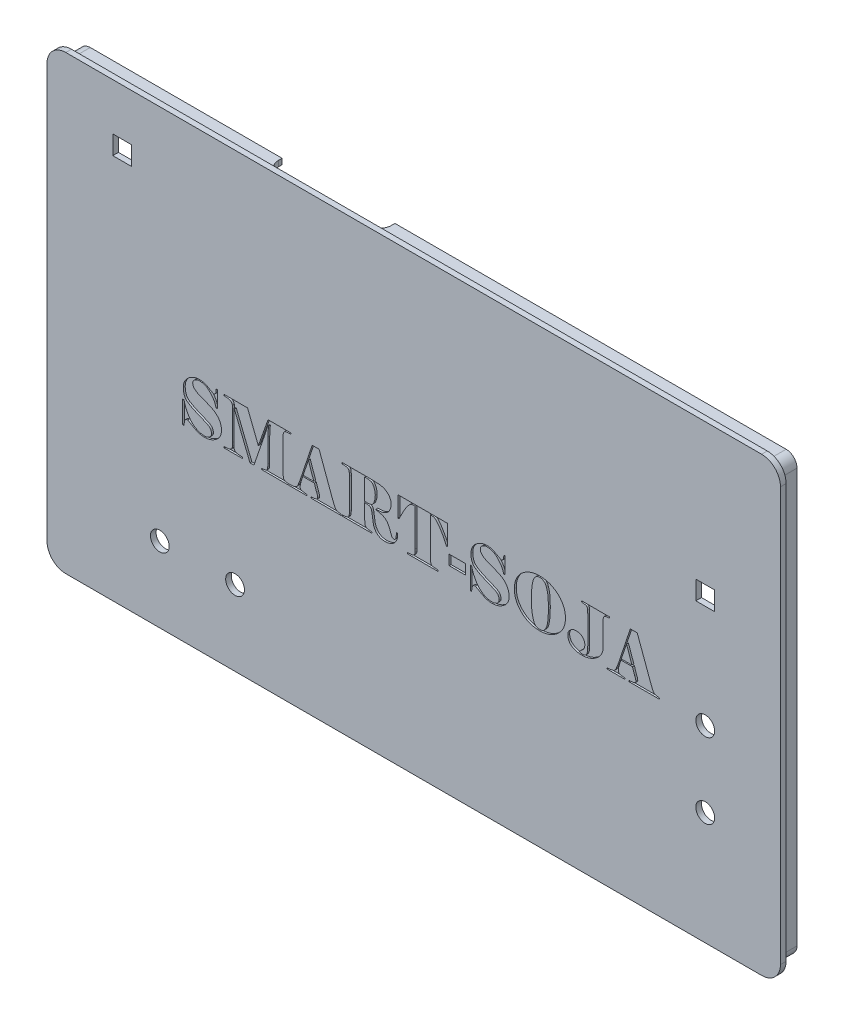
from build123d import *

# Parameters (mm, degrees)
BOSS_EXTRU_1_DEPTH      = 1.5
BOSS_EXTRU_2_DEPTH      = 5
ENL_V_MAT_EXTRU_1_DEPTH = 5
ESQUISSE4_R             = 2.5
ENL_V_MAT_EXTRU_2_DEPTH = 5
ESQUISSE5_W             = 5
ESQUISSE5_H             = 5
ENL_V_MAT_EXTRU_3_DEPTH = 5
ESQUISSE6_W             = 4.3693928
ESQUISSE6_H             = 2.652845629
ENL_V_MAT_EXTRU_4_DEPTH = 0.5


with BuildPart() as part:
    # Esquisse1 → Boss.-Extru.1 (new body)
    with BuildSketch(Plane.XY):
        with BuildLine():
            Line((5, 0), (190, 0))
            ThreePointArc((190, 0), (193.535533906, 1.464466094), (195, 5))
            Line((195, 5), (195, 115))
            ThreePointArc((195, 115), (193.535533906, 118.535533906), (190, 120))
            Line((190, 120), (5, 120))
            ThreePointArc((5, 120), (1.464466094, 118.535533906), (0, 115))
            Line((0, 115), (0, 5))
            ThreePointArc((0, 5), (1.464466094, 1.464466094), (5, 0))
        make_face()
    extrude(amount=BOSS_EXTRU_1_DEPTH)

    # Esquisse2 → Boss.-Extru.2 (add)
    with BuildSketch(Plane(origin=(0, 0, 0), x_dir=(-1, 0, 0), z_dir=(0, 0, -1))):
        with BuildLine():
            Line((-190, 2.1), (-5, 2.1))
            ThreePointArc((-5, 2.1), (-2.949390335, 2.949390335), (-2.1, 5))
            Line((-2.1, 5), (-2.1, 115))
            ThreePointArc((-2.1, 115), (-2.949390335, 117.050609665), (-5, 117.9))
            Line((-5, 117.9), (-190, 117.9))
            ThreePointArc((-190, 117.9), (-192.050609665, 117.050609665), (-192.9, 115))
            Line((-192.9, 115), (-192.9, 5))
            ThreePointArc((-192.9, 5), (-192.050609665, 2.949390335), (-190, 2.1))
        make_face()
        with BuildLine():
            Line((-190, 3.6), (-5, 3.6))
            ThreePointArc((-5, 3.6), (-4.010050506, 4.010050506), (-3.6, 5))
            Line((-3.6, 5), (-3.6, 115))
            ThreePointArc((-3.6, 115), (-4.010050506, 115.989949494), (-5, 116.4))
            Line((-5, 116.4), (-190, 116.4))
            ThreePointArc((-190, 116.4), (-190.989949494, 115.989949494), (-191.4, 115))
            Line((-191.4, 115), (-191.4, 5))
            ThreePointArc((-191.4, 5), (-190.989949494, 4.010050506), (-190, 3.6))
        make_face(mode=Mode.SUBTRACT)
    extrude(amount=BOSS_EXTRU_2_DEPTH)

    # Esquisse3 → Enlèv. mat.-Extru.1 (cut)
    with BuildSketch(Plane(origin=(0, 117.9, 0), x_dir=(1, 0, 0), z_dir=(0, 1, 0))):
        with BuildLine():
            Line((56, 5), (86, 5))
            Line((86, 5), (86, 4))
            ThreePointArc((86, 4), (85.121320344, 1.878679656), (83, 1))
            Line((83, 1), (59, 1))
            ThreePointArc((59, 1), (56.878679656, 1.878679656), (56, 4))
            Line((56, 4), (56, 5))
        make_face()
    extrude(amount=-ENL_V_MAT_EXTRU_1_DEPTH, mode=Mode.SUBTRACT)

    # Esquisse4 → Enlèv. mat.-Extru.2 (cut)
    with BuildSketch(Plane.XY.offset(1.5)):
        with Locations((30, 20)):
            Circle(ESQUISSE4_R)
        with Locations((50, 20)):
            Circle(ESQUISSE4_R)
        with Locations((175, 50)):
            Circle(ESQUISSE4_R)
        with Locations((175, 30)):
            Circle(ESQUISSE4_R)
    extrude(amount=-ENL_V_MAT_EXTRU_2_DEPTH, mode=Mode.SUBTRACT)

    # Esquisse5 → Enlèv. mat.-Extru.3 (cut)
    with BuildSketch(Plane.XY.offset(1.5)):
        with Locations((175, 80)):
            Rectangle(ESQUISSE5_W, ESQUISSE5_H)
        with Locations((20, 105)):
            Rectangle(ESQUISSE5_W, ESQUISSE5_H)
    extrude(amount=-ENL_V_MAT_EXTRU_3_DEPTH, mode=Mode.SUBTRACT)

    # Esquisse6 → Enlèv. mat.-Extru.4 (cut)
    # profile 1 of 10: a face of its own
    with BuildSketch(Plane.XY.offset(1.5)):
        with BuildLine():
            add(Edge.make_bspline(
                [(46.39163123, 53.64766274), (46.387533953, 53.511673528), (46.379485564, 53.244546364), (46.312296236, 52.852726032), (46.198904992, 52.480994989), (46.045498017, 52.125705335), (45.841977188, 51.792423584), (45.597287318, 51.475265037), (45.303754084, 51.180898705), (44.975147254, 50.905788926), (44.620342088, 50.658723814), (44.253987273, 50.440344135), (43.879804417, 50.256560965), (43.49711664, 50.106990197), (43.106385426, 49.990222972), (42.708129786, 49.903349708), (42.301428774, 49.854489483), (42.028050702, 49.847476846), (41.890571459, 49.843950257)],
                knots=[0, 0, 0, 0, 1.00009757, 1.964517807, 2.914178975, 3.854093948, 4.803755116, 5.77980362, 6.79466672, 7.855864323, 8.929224374, 9.972220948, 10.991163209, 11.992814961, 12.991731883, 13.988677953, 14.988525199, 16, 16, 16, 16], degree=3))
            add(Edge.make_bspline(
                [(41.890571459, 49.843950257), (41.768577277, 49.847224302), (41.524802925, 49.853766648), (41.160068953, 49.892429425), (40.79823166, 49.96303579), (40.435579764, 50.05410212), (40.075201369, 50.178564985), (39.712991476, 50.323253456), (39.355147439, 50.500446651), (39.006346872, 50.69791869), (38.679712425, 50.898227484), (38.37777251, 51.069455861), (38.118442274, 51.220983404), (37.892453331, 51.338868244), (37.706757674, 51.437359079), (37.554651448, 51.500252331), (37.444281492, 51.548995454), (37.379986707, 51.557313448), (37.355375807, 51.560497429)],
                knots=[0, 0, 0, 0, 1.191920636, 2.381750298, 3.577683791, 4.790887597, 6.031223829, 7.29920578, 8.59883538, 9.928364723, 11.213776967, 12.341394632, 13.319310994, 14.146917292, 14.832227275, 15.369147203, 15.758520767, 16, 16, 16, 16], degree=3))
            add(Edge.make_bspline(
                [(37.355375807, 51.560497429), (37.270208805, 51.556829681), (37.11386622, 51.550096731), (36.901863154, 51.476793998), (36.74123783, 51.346281127), (36.64540204, 51.154796759), (36.585686991, 50.91531345), (36.52266294, 50.618075409), (36.459433602, 50.253809392), (36.423767226, 49.987956042), (36.404447686, 49.843950257)],
                knots=[0, 0, 0, 0, 0.923718831, 1.695687151, 2.398654704, 3.114841231, 3.97951149, 5.082352304, 6.419586796, 8, 8, 8, 8], degree=3))
            Line((36.404447686, 49.843950257), (36.0923482, 49.843950257))
            Line((36.0923482, 49.843950257), (36.0923482, 55.773840487))
            Line((36.0923482, 55.773840487), (36.404447686, 55.773840487))
            add(Edge.make_bspline(
                [(36.404447686, 55.773840487), (36.423734026, 55.706316526), (36.467736476, 55.552258276), (36.547764825, 55.294061563), (36.638499486, 54.977666504), (36.748018261, 54.606748451), (36.895584534, 54.189080398), (37.098342342, 53.733163086), (37.351803523, 53.238706154), (37.6452504, 52.71266811), (37.992907261, 52.188157131), (38.404871229, 51.70325226), (38.870579467, 51.267767353), (39.293824445, 50.940761939), (39.659263689, 50.71366585), (39.945450413, 50.564827743), (40.241381677, 50.436343798), (40.549556819, 50.335259242), (40.867732645, 50.253195626), (41.197435374, 50.198752106), (41.537062368, 50.163301458), (41.76694156, 50.158486189), (41.883256627, 50.156049743)],
                knots=[0, 0, 0, 0, 0.495910087, 1.131436012, 1.908819045, 2.820327239, 3.86239225, 5.034370654, 6.34092765, 7.785425104, 9.286602305, 10.777020609, 12.267184696, 13.782504941, 14.54545133, 15.302785273, 16.058704145, 16.821024168, 17.590848346, 18.376870872, 19.178723519, 20, 20, 20, 20], degree=3))
            add(Edge.make_bspline(
                [(41.883256627, 50.156049743), (42.013720624, 50.160951296), (42.264977463, 50.170391057), (42.622860285, 50.24932421), (42.943864586, 50.379207458), (43.220806167, 50.559266603), (43.448932157, 50.774498376), (43.616315927, 51.016507135), (43.722111129, 51.281623945), (43.733188782, 51.466892992), (43.738785601, 51.560497429)],
                knots=[0, 0, 0, 0, 1.211792235, 2.333755634, 3.387521299, 4.414452149, 5.387077298, 6.284063922, 7.133048759, 8, 8, 8, 8], degree=3))
            add(Edge.make_bspline(
                [(43.738785601, 51.560497429), (43.734372231, 51.676290084), (43.725950314, 51.897254124), (43.655231596, 52.210165844), (43.534509614, 52.485117255), (43.390735197, 52.683297303), (43.249040526, 52.823491351), (43.123894824, 52.928120487), (42.980153849, 53.033076934), (42.815469265, 53.134871163), (42.632331697, 53.237189842), (42.430688331, 53.339061685), (42.20937975, 53.439790114), (41.71222894, 53.641564681), (40.926269982, 53.958836073), (40.029148034, 54.318413468), (39.281229701, 54.641554441), (38.700002153, 54.933904695), (38.100079902, 55.263365455), (37.701453994, 55.507222182), (37.496795886, 55.632420407)],
                knots=[0, 0, 0, 0, 0.799441783, 1.525553468, 2.201828308, 2.86121988, 3.202733248, 3.577364721, 3.987368499, 4.431455917, 4.914200143, 5.436605481, 5.992018281, 6.593791735, 9.143593654, 11.848832922, 13.272100165, 14.771488724, 16.342453428, 18, 18, 18, 18], degree=3))
            add(Edge.make_bspline(
                [(37.496795886, 55.632420407), (37.396769418, 55.699986184), (37.197486641, 55.834597512), (36.941539341, 56.094294443), (36.725524187, 56.394979631), (36.549493039, 56.737981122), (36.412896274, 57.122594051), (36.317407573, 57.549101356), (36.258306613, 58.017840755), (36.251790872, 58.344410202), (36.248397943, 58.514464096)],
                knots=[0, 0, 0, 0, 0.879506961, 1.752242123, 2.644842821, 3.573726838, 4.55723796, 5.616652785, 6.758924086, 8, 8, 8, 8], degree=3))
            add(Edge.make_bspline(
                [(36.248397943, 58.514464096), (36.251594914, 58.650469961), (36.257910351, 58.919141861), (36.324671944, 59.312886956), (36.426364921, 59.691831123), (36.571102521, 60.054385679), (36.757712998, 60.400366306), (36.987007416, 60.729010169), (37.257087633, 61.042159642), (37.564031298, 61.3359068), (37.897311503, 61.603646498), (38.247210978, 61.840307672), (38.611834472, 62.036520274), (38.986197502, 62.203524123), (39.375472142, 62.326052756), (39.775748971, 62.416804599), (40.188532713, 62.47568146), (40.468856938, 62.48119434), (40.610475912, 62.48397943)],
                knots=[0, 0, 0, 0, 0.99734844, 1.970205483, 2.922414768, 3.872847281, 4.828358163, 5.801361506, 6.808138282, 7.858658923, 8.915124489, 9.942560721, 10.954238571, 11.950605342, 12.946686356, 13.943767164, 14.961197215, 16, 16, 16, 16], degree=3))
            add(Edge.make_bspline(
                [(40.610475912, 62.48397943), (40.768589889, 62.479348026), (41.084711022, 62.470088346), (41.553531496, 62.378194224), (42.018173566, 62.242562206), (42.313853514, 62.106611362), (42.463566609, 62.037774697)],
                knots=[0, 0, 0, 0, 0.985884368, 1.971102674, 2.972698356, 4, 4, 4, 4], degree=3))
            Line((42.463566609, 62.037774697), (44.202058275, 61.079531744))
            add(Edge.make_bspline(
                [(44.202058275, 61.079531744), (44.276930793, 61.082898962), (44.417740616, 61.089231558), (44.606571405, 61.171081925), (44.754691126, 61.303223295), (44.844647819, 61.489779894), (44.906117991, 61.704362025), (44.956213416, 61.943168088), (44.981236514, 62.206291477), (44.985146062, 62.388842144), (44.987183544, 62.48397943)],
                knots=[0, 0, 0, 0, 0.979934061, 1.842923758, 2.653681973, 3.539601387, 4.524899239, 5.59552028, 6.746892144, 8, 8, 8, 8], degree=3))
            Line((44.987183544, 62.48397943), (45.29928303, 62.48397943))
            Line((45.29928303, 62.48397943), (45.29928303, 58.11458663))
            Line((45.29928303, 58.11458663), (44.987183544, 58.11458663))
            add(Edge.make_bspline(
                [(44.987183544, 58.11458663), (44.970464526, 58.169967089), (44.93190421, 58.29769516), (44.856995855, 58.511457716), (44.764888703, 58.775561924), (44.650601763, 59.086794857), (44.496841522, 59.435707965), (44.282194412, 59.808083854), (44.003066079, 60.195707926), (43.681483131, 60.594548067), (43.330716568, 60.972752394), (42.976358624, 61.312267065), (42.616693452, 61.585482541), (42.255946604, 61.808017961), (41.876179067, 61.976668501), (41.464182885, 62.088288507), (41.018675776, 62.161800786), (40.709134356, 62.168450838), (40.549518981, 62.171879945)],
                knots=[0, 0, 0, 0, 0.4293975, 0.990351393, 1.681128606, 2.505933444, 3.451193497, 4.507884268, 5.689727921, 6.993858877, 8.308886504, 9.516869249, 10.631893251, 11.655262045, 12.657496312, 13.704235795, 14.816186658, 16, 16, 16, 16], degree=3))
            add(Edge.make_bspline(
                [(40.549518981, 62.171879945), (40.440150204, 62.167491544), (40.222796388, 62.158770265), (39.903446893, 62.078862039), (39.596806073, 61.951577644), (39.357901941, 61.804947274), (39.179621199, 61.671932919), (39.063887999, 61.560940249), (38.966282941, 61.443632484), (38.884565223, 61.321762713), (38.822151954, 61.192057824), (38.779141058, 61.05567223), (38.75114465, 60.913222883), (38.747189598, 60.816327083), (38.745193829, 60.767432259)],
                knots=[0, 0, 0, 0, 1.559654524, 3.099576244, 4.670977232, 6.285343236, 7.088573484, 7.843827534, 8.569052157, 9.264403608, 9.934094719, 10.61683525, 11.30203789, 12, 12, 12, 12], degree=3))
            add(Edge.make_bspline(
                [(38.745193829, 60.767432259), (38.749657318, 60.664363791), (38.758319016, 60.464352546), (38.84639324, 60.178081189), (38.985903896, 59.918158437), (39.18365784, 59.692259404), (39.413866179, 59.494277126), (39.658668787, 59.310242332), (39.922979576, 59.150471101), (40.21072776, 59.00966088), (40.53569674, 58.874945835), (40.905525607, 58.723825071), (41.330431054, 58.555067655), (41.804570581, 58.374701678), (42.310680302, 58.174513181), (42.83405359, 57.960079952), (43.36334813, 57.721599515), (43.812424152, 57.5225686), (44.16570282, 57.341612254), (44.423069788, 57.194937961), (44.663670349, 57.026146363), (44.897267869, 56.850215675), (45.113965097, 56.653431622), (45.319203799, 56.442705139), (45.514676839, 56.219347194), (45.694682745, 55.980561366), (45.858422698, 55.729297088), (46.003520302, 55.466274926), (46.122391644, 55.189663156), (46.21984175, 54.90245014), (46.299286082, 54.605520631), (46.350791523, 54.295979637), (46.387691897, 53.976096695), (46.390304096, 53.758309836), (46.39163123, 53.64766274)],
                knots=[0, 0, 0, 0, 0.876502026, 1.700910718, 2.528865269, 3.374496475, 4.243514888, 5.115319642, 5.982927692, 6.872401538, 7.844234599, 8.98185382, 10.279024454, 11.742306478, 13.307153541, 14.9197171, 16.564115833, 18.257194608, 19.106424441, 19.947956696, 20.780279058, 21.610550543, 22.439867077, 23.272968025, 24.117860613, 24.968869945, 25.820387023, 26.673228455, 27.526773493, 28.383659779, 29.257720176, 30.144111102, 31.057111535, 32, 32, 32, 32], degree=3))
        make_face()
    # profile 2 of 10: a face of its own
    with BuildSketch(Plane.XY.offset(1.5)):
        with BuildLine():
            Line((49.668675831, 60.29928303), (49.668675831, 52.379758579))
            Line((49.668675831, 52.379758579), (49.702811712, 51.56781226))
            add(Edge.make_bspline(
                [(49.702811712, 51.56781226), (49.713715846, 51.482093499), (49.734308528, 51.320211845), (49.795637301, 51.095435712), (49.877345952, 50.902758613), (49.984307554, 50.739395606), (50.126075893, 50.606814965), (50.308894864, 50.511242796), (50.52433114, 50.43371859), (50.683930542, 50.409989133), (50.768338863, 50.397439189)],
                knots=[0, 0, 0, 0, 1.180791605, 2.229949378, 3.175900595, 4.033087221, 4.882670352, 5.798347502, 6.835598461, 8, 8, 8, 8], degree=3))
            Line((50.768338863, 50.397439189), (51.989915756, 50.312099486))
            Line((51.989915756, 50.312099486), (51.989915756, 50))
            Line((51.989915756, 50), (47.09629335, 50))
            Line((47.09629335, 50), (47.09629335, 50.312099486))
            add(Edge.make_bspline(
                [(47.09629335, 50.312099486), (47.184043007, 50.317601506), (47.366763883, 50.329058347), (47.65902474, 50.334359347), (47.993500278, 50.358424993), (48.300400885, 50.390293247), (48.558930322, 50.441852459), (48.740306383, 50.512210887), (48.897584156, 50.615529379), (49.033865736, 50.745909289), (49.144115616, 50.907568089), (49.229599976, 51.097507923), (49.294021868, 51.315589514), (49.312668109, 51.473080848), (49.322440464, 51.555620874)],
                knots=[0, 0, 0, 0, 1.088681475, 2.266958535, 3.618688853, 5.240381737, 6.085350881, 6.875939365, 7.632479768, 8.401240364, 9.196937712, 10.039084781, 10.972299039, 12, 12, 12, 12], degree=3))
            Line((49.322440464, 51.555620874), (49.356576345, 52.360252361))
            Line((49.356576345, 52.360252361), (49.356576345, 60.152986396))
            Line((49.356576345, 60.152986396), (49.320002186, 60.923482002))
            add(Edge.make_bspline(
                [(49.320002186, 60.923482002), (49.298310518, 60.989291294), (49.255983407, 61.117705443), (49.16194157, 61.293758582), (49.059202167, 61.457082448), (48.933948596, 61.598306933), (48.79467712, 61.718150865), (48.643057419, 61.816763395), (48.472776733, 61.879718515), (48.232786523, 61.927296054), (47.926897261, 61.960296116), (47.624632948, 61.977530865), (47.397078353, 61.991746441), (47.249742952, 61.99705695), (47.125600631, 62.008372327), (47.04997427, 62.013510431), (47.015830202, 62.015830202)],
                knots=[0, 0, 0, 0, 1.040607395, 2.030544763, 2.993838035, 3.938318236, 4.857522136, 5.753242602, 6.643520453, 7.569370654, 9.429009052, 11.267416851, 12.124836776, 12.859487778, 13.485077342, 14, 14, 14, 14], degree=3))
            Line((47.015830202, 62.015830202), (47.015830202, 62.327929688))
            Line((47.015830202, 62.327929688), (53.326091679, 62.327929688))
            Line((53.326091679, 62.327929688), (56.193505705, 55.074054921))
            Line((56.193505705, 55.074054921), (58.768326462, 62.327929688))
            Line((58.768326462, 62.327929688), (64.883525761, 62.327929688))
            Line((64.883525761, 62.327929688), (64.883525761, 62.015830202))
            Line((64.883525761, 62.015830202), (64.495839682, 62.015830202))
            add(Edge.make_bspline(
                [(64.495839682, 62.015830202), (64.460074868, 62.014295088), (64.373861498, 62.010594597), (64.221661388, 62.001273165), (64.024370529, 61.979791281), (63.794550262, 61.956439347), (63.56185711, 61.922838966), (63.355072738, 61.868248541), (63.18965707, 61.793704286), (63.057772032, 61.699897748), (62.959260489, 61.574086798), (62.892968034, 61.413308093), (62.83421603, 61.221913167), (62.817510702, 61.080033504), (62.808551837, 61.00394515)],
                knots=[0, 0, 0, 0, 0.574857276, 1.38573024, 2.448042293, 3.761060899, 5.095696551, 6.219790428, 7.183303074, 7.995120805, 8.794143213, 9.711188391, 10.772537914, 12, 12, 12, 12], degree=3))
            Line((62.808551837, 61.00394515), (62.776854233, 60.29928303))
            Line((62.776854233, 60.29928303), (62.776854233, 52.206640895))
            Line((62.776854233, 52.206640895), (62.808551837, 51.421515627))
            add(Edge.make_bspline(
                [(62.808551837, 51.421515627), (62.818411618, 51.337579381), (62.836738931, 51.181559103), (62.883811815, 50.969177871), (62.946171161, 50.796385365), (63.02779335, 50.65707699), (63.148791964, 50.551547813), (63.309062369, 50.47772038), (63.508211329, 50.415670435), (63.656586949, 50.392831414), (63.737535462, 50.380371248)],
                knots=[0, 0, 0, 0, 1.288094477, 2.394303626, 3.308027556, 4.081698434, 4.827785203, 5.714472145, 6.753096487, 8, 8, 8, 8], degree=3))
            Line((63.737535462, 50.380371248), (64.578741107, 50.312099486))
            Line((64.578741107, 50.312099486), (64.578741107, 50))
            Line((64.578741107, 50), (56.96400131, 50))
            Line((56.96400131, 50), (56.96400131, 50.312099486))
            Line((56.96400131, 50.312099486), (57.749126579, 50.363303308))
            add(Edge.make_bspline(
                [(57.749126579, 50.363303308), (57.83221213, 50.375762255), (57.984289538, 50.398566753), (58.189563013, 50.448377033), (58.346563961, 50.519602684), (58.471365424, 50.606013317), (58.551946125, 50.738295271), (58.613346604, 50.906136049), (58.657158288, 51.12171944), (58.675419868, 51.280745953), (58.685425036, 51.367873527)],
                knots=[0, 0, 0, 0, 1.287597348, 2.35678124, 3.220361743, 3.922644693, 4.640971293, 5.547472163, 6.656307056, 8, 8, 8, 8], degree=3))
            Line((58.685425036, 51.367873527), (58.719560918, 52.138369133))
            Line((58.719560918, 52.138369133), (58.719560918, 58.358414353))
            add(Edge.make_bspline(
                [(58.719560918, 58.358414353), (58.719878345, 58.448640373), (58.720544829, 58.638082992), (58.731823286, 58.933914112), (58.745446919, 59.254258502), (58.77598238, 59.705310736), (58.816318353, 60.264724809), (58.856302618, 60.708963253), (58.875610661, 60.923482002)],
                knots=[0, 0, 0, 0, 0.63174092, 1.326431708, 2.072751143, 2.876833313, 4.491850898, 6, 6, 6, 6], degree=3))
            Line((58.875610661, 60.923482002), (58.719560918, 60.923482002))
            Line((58.719560918, 60.923482002), (58.024651906, 58.753415265))
            Line((58.024651906, 58.753415265), (55.018256079, 50))
            Line((55.018256079, 50), (53.967358592, 50))
            Line((53.967358592, 50), (49.824725574, 60.29928303))
            Line((49.824725574, 60.29928303), (49.668675831, 60.29928303))
        make_face()
    # profile 3 of 10: a face of its own
    with BuildSketch(Plane.XY.offset(1.5)):
        with BuildLine():
            Line((67.97769957, 53.901243572), (67.468099628, 52.14080741))
            add(Edge.make_bspline(
                [(67.468099628, 52.14080741), (67.442497315, 52.045176793), (67.394172188, 51.864671154), (67.344613988, 51.607060038), (67.308511973, 51.381070209), (67.304263626, 51.240383234), (67.302296776, 51.175249626)],
                knots=[0, 0, 0, 0, 1.20899125, 2.282006996, 3.204623725, 4, 4, 4, 4], degree=3))
            add(Edge.make_bspline(
                [(67.302296776, 51.175249626), (67.304207053, 51.114868412), (67.307760261, 51.002556416), (67.343911077, 50.849258655), (67.402398697, 50.722949778), (67.518459268, 50.596056289), (67.716062243, 50.492567428), (67.981429794, 50.414409376), (68.266684375, 50.370354375), (68.551965739, 50.344856059), (68.828703177, 50.329814477), (69.009915209, 50.317951495), (69.099307096, 50.312099486)],
                knots=[0, 0, 0, 0, 0.802403374, 1.492509319, 2.082793767, 2.634437384, 3.749595355, 4.995194128, 6.311336228, 7.582696871, 8.807544476, 10, 10, 10, 10], degree=3))
            Line((69.099307096, 50.312099486), (69.099307096, 50))
            Line((69.099307096, 50), (64.337351661, 50))
            Line((64.337351661, 50), (64.337351661, 50.312099486))
            Line((64.337351661, 50.312099486), (65.361428099, 50.380371248))
            add(Edge.make_bspline(
                [(65.361428099, 50.380371248), (65.451170767, 50.392281454), (65.620896947, 50.414806677), (65.855697574, 50.475575713), (66.056817656, 50.553325221), (66.226673142, 50.649087967), (66.366685515, 50.764322474), (66.488474898, 50.889276527), (66.589611724, 51.030240112), (66.701478766, 51.245920684), (66.832299225, 51.552246335), (66.998934491, 51.942001513), (67.162991761, 52.338561664), (67.257734679, 52.603717045), (67.302296776, 52.728432223)],
                knots=[0, 0, 0, 0, 0.992109096, 1.876330291, 2.652611543, 3.351330053, 4.004199234, 4.634594798, 5.260436884, 5.898536142, 7.294977887, 8.912451373, 10.547779143, 12, 12, 12, 12], degree=3))
            Line((67.302296776, 52.728432223), (70.496439951, 62.327929688))
            Line((70.496439951, 62.327929688), (72.337339261, 62.327929688))
            Line((72.337339261, 62.327929688), (75.867964694, 52.728432223))
            Line((75.867964694, 52.728432223), (76.384879467, 51.419077349))
            add(Edge.make_bspline(
                [(76.384879467, 51.419077349), (76.422583796, 51.337953306), (76.493614303, 51.18512518), (76.61326074, 50.979806696), (76.732199764, 50.810101876), (76.854016246, 50.670695904), (76.994723145, 50.564442283), (77.15506675, 50.482221769), (77.338712325, 50.417282309), (77.471064307, 50.393087179), (77.540622875, 50.380371248)],
                knots=[0, 0, 0, 0, 1.308443525, 2.464953226, 3.471397525, 4.338570861, 5.161561706, 6.033938454, 6.966721725, 8, 8, 8, 8], degree=3))
            Line((77.540622875, 50.380371248), (78.225778778, 50.312099486))
            Line((78.225778778, 50.312099486), (78.225778778, 50))
            Line((78.225778778, 50), (70.203846683, 50))
            Line((70.203846683, 50), (70.203846683, 50.312099486))
            add(Edge.make_bspline(
                [(70.203846683, 50.312099486), (70.269680099, 50.312813126), (70.393237841, 50.314152504), (70.550206136, 50.317184691), (70.68538574, 50.3263168), (70.817429231, 50.345931805), (70.983467698, 50.366734776), (71.172446278, 50.393856298), (71.362975407, 50.428300968), (71.535080058, 50.467567852), (71.675238736, 50.51730348), (71.793030187, 50.565627818), (71.8839182, 50.641996317), (71.945423118, 50.749221293), (71.97767215, 50.886534705), (71.981627844, 50.986517923), (71.983789062, 51.041144378)],
                knots=[0, 0, 0, 0, 1.28580551, 2.413230755, 3.065760813, 3.930070775, 5.018842875, 6.334286719, 7.657464883, 8.800867035, 9.774694406, 10.562925759, 11.272252287, 12.048079921, 12.933556266, 14, 14, 14, 14], degree=3))
            add(Edge.make_bspline(
                [(71.983789062, 51.041144378), (71.979234576, 51.109707526), (71.969076732, 51.26262351), (71.903888998, 51.509552553), (71.806569278, 51.797236029), (71.718884761, 51.998398265), (71.671689577, 52.106671529)],
                knots=[0, 0, 0, 0, 0.736914081, 1.643535135, 2.731659852, 4, 4, 4, 4], degree=3))
            Line((71.671689577, 52.106671529), (71.079188209, 53.901243572))
            Line((71.079188209, 53.901243572), (67.97769957, 53.901243572))
        make_face()
        Polygon((70.945082961, 54.213343058), (69.494308008, 58.346222967), (68.094736877, 54.213343058), align=None, mode=Mode.SUBTRACT)
    # profile 4 of 10: a face of its own
    with BuildSketch(Plane.XY.offset(1.5)):
        with BuildLine():
            Line((84.467768493, 56.085939972), (84.467768493, 52.204202618))
            Line((84.467768493, 52.204202618), (84.501904374, 51.441021844))
            add(Edge.make_bspline(
                [(84.501904374, 51.441021844), (84.513104729, 51.358646871), (84.534084476, 51.204347642), (84.590475939, 50.990886963), (84.674019518, 50.815552755), (84.778294693, 50.669343119), (84.922522832, 50.561479501), (85.099342334, 50.475820458), (85.315823541, 50.414710874), (85.473630385, 50.390713819), (85.557678416, 50.377932971)],
                knots=[0, 0, 0, 0, 1.19329532, 2.235200095, 3.153818476, 3.970668683, 4.785348854, 5.70906722, 6.779847659, 8, 8, 8, 8], degree=3))
            Line((85.557678416, 50.377932971), (86.454964437, 50.312099486))
            Line((86.454964437, 50.312099486), (86.454964437, 50))
            Line((86.454964437, 50), (78.372075412, 50))
            Line((78.372075412, 50), (78.372075412, 50.312099486))
            Line((78.372075412, 50.312099486), (78.893866739, 50.312099486))
            add(Edge.make_bspline(
                [(78.893866739, 50.312099486), (79.014895835, 50.329008415), (79.250359013, 50.361904886), (79.540982465, 50.39323666), (79.758572091, 50.430885363), (79.903344548, 50.482695038), (80.029848094, 50.55621685), (80.138995381, 50.65487097), (80.230950135, 50.786069822), (80.298675886, 50.95705775), (80.349010085, 51.167315027), (80.366751499, 51.32125539), (80.376339297, 51.404447686)],
                knots=[0, 0, 0, 0, 1.735105699, 3.375663499, 4.152038245, 4.863971761, 5.546873415, 6.216876895, 6.937365824, 7.801206521, 8.81173025, 10, 10, 10, 10], degree=3))
            Line((80.376339297, 51.404447686), (80.410475178, 52.174943291))
            Line((80.410475178, 52.174943291), (80.410475178, 60.135918455))
            Line((80.410475178, 60.135918455), (80.376339297, 60.906414061))
            add(Edge.make_bspline(
                [(80.376339297, 60.906414061), (80.366992404, 60.989669998), (80.34958658, 61.144709562), (80.295997316, 61.355146075), (80.227963012, 61.529484822), (80.131452061, 61.664122012), (80.015078033, 61.766710128), (79.880333753, 61.84622344), (79.724014657, 61.902724915), (79.496319034, 61.940631596), (79.223995465, 61.974594474), (78.922352404, 61.98870028), (78.655628752, 62.000024067), (78.487474758, 62.010680357), (78.406211293, 62.015830202)],
                knots=[0, 0, 0, 0, 1.156698729, 2.154009328, 2.994898728, 3.727579875, 4.419869184, 5.125074271, 5.878563505, 6.702622802, 8.30936365, 9.671053573, 10.874494421, 12, 12, 12, 12], degree=3))
            Line((78.406211293, 62.015830202), (78.406211293, 62.327929688))
            Line((78.406211293, 62.327929688), (85.974623823, 62.344997628))
            add(Edge.make_bspline(
                [(85.974623823, 62.344997628), (86.103037364, 62.344230496), (86.354183547, 62.342730169), (86.721660969, 62.339769124), (87.070262898, 62.32569627), (87.399579619, 62.3127106), (87.709933365, 62.291674434), (88.002120573, 62.272211398), (88.275732786, 62.240910364), (88.610412941, 62.201700196), (88.997128212, 62.132731071), (89.424842382, 62.015335116), (89.805049841, 61.858746463), (90.142371851, 61.670102748), (90.435063046, 61.445831579), (90.702315019, 61.205755145), (90.93181202, 60.93445501), (91.130831473, 60.641260676), (91.29379194, 60.32401498), (91.409373467, 59.979104411), (91.478531144, 59.609600079), (91.486127773, 59.354345972), (91.490006922, 59.224002771)],
                knots=[0, 0, 0, 0, 1.072481731, 2.09751782, 3.068755375, 3.986002578, 4.849752011, 5.666566428, 6.431142501, 7.149295154, 8.48069281, 9.707694629, 10.845949449, 11.906768728, 12.924927194, 13.919392334, 14.901526847, 15.884247575, 16.873859428, 17.869829143, 18.912247517, 20, 20, 20, 20], degree=3))
            add(Edge.make_bspline(
                [(91.490006922, 59.224002771), (91.488082665, 59.123872851), (91.484217463, 58.92274459), (91.439297218, 58.622120064), (91.374377543, 58.320946866), (91.282041857, 58.022946182), (91.16542558, 57.734760454), (91.016726103, 57.464562591), (90.839320092, 57.216401599), (90.632366878, 56.990419227), (90.399133316, 56.787016301), (90.139928521, 56.60647699), (89.854166965, 56.449095792), (89.594538666, 56.339570935), (89.36425883, 56.263954955), (89.165011615, 56.217171313), (88.942309593, 56.174713278), (88.69527023, 56.145273851), (88.425494012, 56.11789773), (88.1311405, 56.098010396), (87.813128415, 56.089942574), (87.592828782, 56.087303231), (87.479040875, 56.085939972)],
                knots=[0, 0, 0, 0, 1.030904265, 2.070749523, 3.125327995, 4.203418597, 5.281151359, 6.323118924, 7.373532839, 8.416812049, 9.473250919, 10.555853126, 11.665329351, 12.828740843, 13.453744117, 14.160576846, 14.935832792, 15.788626668, 16.722740479, 17.729901482, 18.827461688, 20, 20, 20, 20], degree=3))
            Line((87.479040875, 56.085939972), (87.479040875, 55.971340942))
            add(Edge.make_bspline(
                [(87.479040875, 55.971340942), (87.611535738, 55.941345354), (87.865355645, 55.883882921), (88.229486985, 55.800183825), (88.558315297, 55.713987548), (88.858513095, 55.63135647), (89.137112135, 55.541870418), (89.397605398, 55.431555451), (89.645794415, 55.304252377), (89.88239661, 55.157392629), (90.109002181, 54.982842481), (90.318831684, 54.766951675), (90.51863726, 54.515191218), (90.703337854, 54.228616156), (90.87481119, 53.91728191), (91.033181488, 53.58976499), (91.172758573, 53.246712054), (91.289007065, 52.899283204), (91.391230468, 52.570808554), (91.497125877, 52.287550952), (91.59261727, 52.055086081), (91.684445855, 51.871205449), (91.784084777, 51.729607371), (91.903997368, 51.631008441), (92.044909711, 51.571001627), (92.145317202, 51.564071819), (92.19710732, 51.560497429)],
                knots=[0, 0, 0, 0, 1.400377924, 2.682698671, 3.851141324, 4.904157175, 5.89238708, 6.8649011, 7.816659248, 8.765129794, 9.732142797, 10.757053339, 11.860076084, 13.040561621, 14.26689349, 15.522217317, 16.788647341, 18.081598174, 19.297698937, 20.334186908, 21.197785785, 21.887291924, 22.450312888, 22.968472214, 23.467938652, 24, 24, 24, 24], degree=3))
            add(Edge.make_bspline(
                [(92.19710732, 51.560497429), (92.23061883, 51.562467166), (92.296312135, 51.566328483), (92.390094594, 51.593837858), (92.476090052, 51.638797464), (92.550787307, 51.70343107), (92.619727873, 51.783552809), (92.673357982, 51.884260473), (92.720513394, 52.001213534), (92.771021259, 52.182780619), (92.820341265, 52.431763513), (92.864664525, 52.747607083), (92.887904499, 53.084075349), (92.892227058, 53.314400573), (92.894454608, 53.433094343)],
                knots=[0, 0, 0, 0, 0.55248176, 1.083041381, 1.598991695, 2.141618649, 2.703142207, 3.333624887, 4.013522607, 4.781732929, 6.438798341, 8.198925449, 10.041187752, 12, 12, 12, 12], degree=3))
            Line((92.894454608, 53.433094343), (93.206554094, 53.433094343))
            add(Edge.make_bspline(
                [(93.206554094, 53.433094343), (93.204792238, 53.299793807), (93.201460361, 53.047706835), (93.186445181, 52.690376602), (93.154593573, 52.376290621), (93.112368276, 52.095690552), (93.04266037, 51.833265827), (92.931905444, 51.575998015), (92.786836857, 51.312765921), (92.60926766, 51.045009671), (92.387720276, 50.788840854), (92.12095517, 50.555465318), (91.811666124, 50.348383134), (91.464658063, 50.169818645), (91.08961089, 50.024688968), (90.694220895, 49.918638137), (90.282528014, 49.857537862), (90.002855247, 49.848517756), (89.861237731, 49.843950257)],
                knots=[0, 0, 0, 0, 1.140444933, 2.156715319, 3.058165393, 3.840004228, 4.582128901, 5.373676576, 6.229319298, 7.151079268, 8.117138984, 9.117202473, 10.173954798, 11.293437028, 12.449040839, 13.607673486, 14.788600898, 16, 16, 16, 16], degree=3))
            add(Edge.make_bspline(
                [(89.861237731, 49.843950257), (89.751412625, 49.84618595), (89.536816315, 49.850554455), (89.223499741, 49.887708137), (88.928348721, 49.948545181), (88.648411623, 50.031350944), (88.386720193, 50.141237623), (88.139309942, 50.272901087), (87.912864919, 50.433101061), (87.701648188, 50.613885507), (87.511539814, 50.816202563), (87.335832394, 51.031631628), (87.182711609, 51.264202939), (87.047898756, 51.511252028), (86.933411572, 51.774370074), (86.835484797, 52.050974069), (86.760199312, 52.344223335), (86.686603365, 52.745683138), (86.618975812, 53.236393532), (86.53801492, 53.791538901), (86.463685654, 54.297609509), (86.4197738, 54.618875804), (86.398884061, 54.771708544)],
                knots=[0, 0, 0, 0, 0.968843385, 1.893102807, 2.779206962, 3.625498008, 4.464586965, 5.279640551, 6.093367869, 6.907031978, 7.728809972, 8.539719699, 9.357230643, 10.18200738, 11.020145702, 11.886586855, 12.768501919, 13.688382592, 15.486649844, 17.138835939, 18.638887576, 20, 20, 20, 20], degree=3))
            add(Edge.make_bspline(
                [(86.398884061, 54.771708544), (86.38249819, 54.848273121), (86.351504417, 54.993094546), (86.297093365, 55.196238903), (86.243052688, 55.375848168), (86.179689164, 55.528681443), (86.114070825, 55.657176551), (86.046089056, 55.761355089), (85.973922268, 55.842986233), (85.866473004, 55.909518129), (85.728836874, 55.966132893), (85.561132844, 56.021221815), (85.385011882, 56.055454442), (85.142747734, 56.075039801), (84.835999585, 56.081681842), (84.590493359, 56.084520813), (84.467768493, 56.085939972)],
                knots=[0, 0, 0, 0, 1.212206605, 2.292881307, 3.256150235, 4.113910111, 4.851321379, 5.486612199, 6.03865837, 6.520375045, 7.427671526, 8.339148315, 9.24992972, 10.197949794, 12.099412336, 14, 14, 14, 14], degree=3))
        make_face()
        with BuildLine():
            add(Edge.make_bspline(
                [(85.899037228, 56.44924328), (85.954832702, 56.459512133), (86.064936746, 56.479776183), (86.220380476, 56.543671699), (86.365681284, 56.627096807), (86.501492503, 56.733466819), (86.625788747, 56.863462523), (86.737955004, 57.016777094), (86.841203363, 57.191400585), (86.96293255, 57.456818356), (87.090817346, 57.814782681), (87.196533209, 58.269817901), (87.264963052, 58.747276932), (87.272710046, 59.074212992), (87.276663865, 59.241070711)],
                knots=[0, 0, 0, 0, 0.606753264, 1.197337057, 1.790678355, 2.398993727, 3.039885449, 3.712566446, 4.431353247, 5.210944033, 6.839784504, 8.496722455, 10.212039079, 12, 12, 12, 12], degree=3))
            add(Edge.make_bspline(
                [(87.276663865, 59.241070711), (87.272641437, 59.379526979), (87.264571399, 59.657306303), (87.192353573, 60.071513892), (87.08018303, 60.482306605), (86.951771673, 60.816712815), (86.829990916, 61.070004632), (86.735746451, 61.242219091), (86.634931794, 61.391985269), (86.531045566, 61.522311111), (86.42007416, 61.630688413), (86.305587281, 61.719809693), (86.185561865, 61.78700543), (86.021793553, 61.842647631), (85.82194946, 61.888286692), (85.592367152, 61.937609681), (85.374539496, 61.965821736), (85.110197672, 61.987435827), (84.809015111, 61.996630508), (84.576654363, 62.009703913), (84.467768493, 62.015830202)],
                knots=[0, 0, 0, 0, 1.61804025, 3.246210048, 4.901752897, 6.592712436, 7.425922628, 8.187534969, 8.886104963, 9.534787758, 10.132972125, 10.69567178, 11.227418483, 11.732504079, 12.7122131, 13.623711122, 14.477272633, 15.278424186, 16.724650547, 18, 18, 18, 18], degree=3))
            Line((84.467768493, 62.015830202), (84.467768493, 56.398039458))
            Line((84.467768493, 56.398039458), (85.074899524, 56.398039458))
            add(Edge.make_bspline(
                [(85.074899524, 56.398039458), (85.154559004, 56.398305422), (85.307443554, 56.398815868), (85.524648834, 56.408131483), (85.719831955, 56.425196135), (85.841380987, 56.441506521), (85.899037228, 56.44924328)],
                knots=[0, 0, 0, 0, 1.156499213, 2.219583443, 3.155467351, 4, 4, 4, 4], degree=3))
        make_face(mode=Mode.SUBTRACT)
    # profile 5 of 10: a face of its own
    with BuildSketch(Plane.XY.offset(1.5)):
        with BuildLine():
            Line((93.301646906, 62.327929688), (106.529300893, 62.327929688))
            Line((106.529300893, 62.327929688), (106.529300893, 56.922269063))
            Line((106.529300893, 56.922269063), (106.241584179, 56.922269063))
            add(Edge.make_bspline(
                [(106.241584179, 56.922269063), (106.162431486, 57.096424288), (106.00085266, 57.451937107), (105.743864429, 57.992104275), (105.45552592, 58.5437468), (105.157870531, 59.107650191), (104.842168484, 59.659835216), (104.518107031, 60.184007989), (104.181376072, 60.668110483), (103.897633906, 61.045391285), (103.669582265, 61.318243339), (103.504946683, 61.494035938), (103.344813798, 61.641729872), (103.192033952, 61.766430316), (103.041187287, 61.859458154), (102.897808441, 61.930463438), (102.756213693, 61.971241734), (102.663224837, 61.978289647), (102.618304212, 61.98169432)],
                knots=[0, 0, 0, 0, 1.438210605, 2.935899892, 4.496355229, 6.117401162, 7.729450999, 9.2774506, 10.748680328, 12.161432012, 12.824878789, 13.421383743, 13.970535839, 14.46199358, 14.901133348, 15.300183171, 15.661935733, 16, 16, 16, 16], degree=3))
            Line((102.618304212, 61.98169432), (101.945339695, 62.015830202))
            Line((101.945339695, 62.015830202), (101.945339695, 52.1846964))
            Line((101.945339695, 52.1846964), (101.979475577, 51.40932424))
            add(Edge.make_bspline(
                [(101.979475577, 51.40932424), (101.988191467, 51.325337155), (102.004238346, 51.170708011), (102.052610853, 50.959987999), (102.116487323, 50.789655848), (102.198656493, 50.655079351), (102.305028708, 50.554317539), (102.434479764, 50.481832914), (102.586750487, 50.430503552), (102.813783429, 50.393439549), (103.096854834, 50.371950146), (103.417015737, 50.345293421), (103.703445448, 50.330836824), (103.882974941, 50.318057297), (103.966671521, 50.312099486)],
                knots=[0, 0, 0, 0, 1.154984533, 2.126449184, 2.950764276, 3.635934529, 4.26546643, 4.933348016, 5.651073086, 6.454092307, 8.074745172, 9.536383944, 10.851463143, 12, 12, 12, 12], degree=3))
            Line((103.966671521, 50.312099486), (103.966671521, 50))
            Line((103.966671521, 50), (95.813072456, 50))
            Line((95.813072456, 50), (95.813072456, 50.312099486))
            Line((95.813072456, 50.312099486), (96.927365151, 50.363303308))
            add(Edge.make_bspline(
                [(96.927365151, 50.363303308), (97.004981257, 50.372570489), (97.148881405, 50.389751831), (97.343050423, 50.44388133), (97.502243757, 50.51110346), (97.624139761, 50.610825788), (97.713377796, 50.744833277), (97.775716557, 50.91810135), (97.827061026, 51.131479997), (97.844472712, 51.289523075), (97.853910499, 51.375188359)],
                knots=[0, 0, 0, 0, 1.203279034, 2.230877584, 3.099937815, 3.847594701, 4.622680574, 5.551141242, 6.672626571, 8, 8, 8, 8], degree=3))
            Line((97.853910499, 51.375188359), (97.888046381, 52.150560519))
            Line((97.888046381, 52.150560519), (97.888046381, 62.015830202))
            Line((97.888046381, 62.015830202), (97.229711528, 61.98169432))
            add(Edge.make_bspline(
                [(97.229711528, 61.98169432), (97.183911328, 61.97942522), (97.089098341, 61.974727855), (96.947781207, 61.931667804), (96.801721636, 61.871258169), (96.654405772, 61.780757251), (96.504757914, 61.664813193), (96.347031036, 61.528526744), (96.18975107, 61.36318992), (95.967803076, 61.107585671), (95.691678069, 60.744135281), (95.361270528, 60.264135944), (95.031158088, 59.730574152), (94.708060505, 59.155486837), (94.395536831, 58.569887234), (94.10250574, 57.998238519), (93.833343009, 57.45358712), (93.669031637, 57.095763456), (93.58936362, 56.922269063)],
                knots=[0, 0, 0, 0, 0.342483276, 0.708989544, 1.099323735, 1.525557476, 1.999485575, 2.517517267, 3.086155294, 3.707910311, 5.054264746, 6.504012944, 8.074366664, 9.754748722, 11.447122894, 13.049047434, 14.569201048, 16, 16, 16, 16], degree=3))
            Line((93.58936362, 56.922269063), (93.301646906, 56.922269063))
            Line((93.301646906, 56.922269063), (93.301646906, 62.327929688))
        make_face()
    # profile 6 of 10: a face of its own
    with BuildSketch(Plane.XY.offset(1.5)):
        with Locations((109.123627868, 54.135318187)):
            Rectangle(ESQUISSE6_W, ESQUISSE6_H)
    # profile 7 of 10: a face of its own
    with BuildSketch(Plane.XY.offset(1.5)):
        with BuildLine():
            add(Edge.make_bspline(
                [(122.856005241, 53.64766274), (122.851907964, 53.511673528), (122.843859575, 53.244546364), (122.776670247, 52.852726032), (122.663279003, 52.480994989), (122.509872028, 52.125705335), (122.306351199, 51.792423584), (122.061661329, 51.475265037), (121.768128095, 51.180898705), (121.439521265, 50.905788926), (121.084716099, 50.658723814), (120.718361284, 50.440344135), (120.344178429, 50.256560965), (119.961490651, 50.106990197), (119.570759437, 49.990222972), (119.172503797, 49.903349708), (118.765802785, 49.854489483), (118.492424713, 49.847476846), (118.35494547, 49.843950257)],
                knots=[0, 0, 0, 0, 1.00009757, 1.964517807, 2.914178975, 3.854093948, 4.803755116, 5.77980362, 6.79466672, 7.855864323, 8.929224374, 9.972220948, 10.991163209, 11.992814961, 12.991731883, 13.988677953, 14.988525199, 16, 16, 16, 16], degree=3))
            add(Edge.make_bspline(
                [(118.35494547, 49.843950257), (118.232951288, 49.847224302), (117.989176936, 49.853766648), (117.624442964, 49.892429425), (117.262605671, 49.96303579), (116.899953775, 50.05410212), (116.53957538, 50.178564985), (116.177365487, 50.323253456), (115.81952145, 50.500446651), (115.470720883, 50.69791869), (115.144086437, 50.898227484), (114.842146521, 51.069455861), (114.582816285, 51.220983404), (114.356827342, 51.338868244), (114.171131686, 51.437359079), (114.019025459, 51.500252331), (113.908655503, 51.548995454), (113.844360718, 51.557313448), (113.819749818, 51.560497429)],
                knots=[0, 0, 0, 0, 1.191920636, 2.381750298, 3.577683791, 4.790887597, 6.031223829, 7.29920578, 8.59883538, 9.928364723, 11.213776967, 12.341394632, 13.319310994, 14.146917292, 14.832227275, 15.369147203, 15.758520767, 16, 16, 16, 16], degree=3))
            add(Edge.make_bspline(
                [(113.819749818, 51.560497429), (113.734582816, 51.556829681), (113.578240231, 51.550096731), (113.366237165, 51.476793998), (113.205611841, 51.346281127), (113.109776051, 51.154796759), (113.050061002, 50.91531345), (112.987036951, 50.618075409), (112.923807613, 50.253809392), (112.888141237, 49.987956042), (112.868821697, 49.843950257)],
                knots=[0, 0, 0, 0, 0.923718831, 1.695687151, 2.398654704, 3.114841231, 3.97951149, 5.082352304, 6.419586796, 8, 8, 8, 8], degree=3))
            Line((112.868821697, 49.843950257), (112.556722211, 49.843950257))
            Line((112.556722211, 49.843950257), (112.556722211, 55.773840487))
            Line((112.556722211, 55.773840487), (112.868821697, 55.773840487))
            add(Edge.make_bspline(
                [(112.868821697, 55.773840487), (112.888108037, 55.706316526), (112.932110488, 55.552258276), (113.012138836, 55.294061563), (113.102873497, 54.977666504), (113.212392272, 54.606748451), (113.359958545, 54.189080398), (113.562716353, 53.733163086), (113.816177534, 53.238706154), (114.109624411, 52.71266811), (114.457281272, 52.188157131), (114.86924524, 51.70325226), (115.334953478, 51.267767353), (115.758198456, 50.940761939), (116.1236377, 50.71366585), (116.409824424, 50.564827743), (116.705755688, 50.436343798), (117.01393083, 50.335259242), (117.332106656, 50.253195626), (117.661809385, 50.198752106), (118.001436379, 50.163301458), (118.231315571, 50.158486189), (118.347630638, 50.156049743)],
                knots=[0, 0, 0, 0, 0.495910087, 1.131436012, 1.908819045, 2.820327239, 3.86239225, 5.034370654, 6.34092765, 7.785425104, 9.286602305, 10.777020609, 12.267184696, 13.782504941, 14.54545133, 15.302785273, 16.058704145, 16.821024168, 17.590848346, 18.376870872, 19.178723519, 20, 20, 20, 20], degree=3))
            add(Edge.make_bspline(
                [(118.347630638, 50.156049743), (118.478094635, 50.160951296), (118.729351474, 50.170391057), (119.087234296, 50.24932421), (119.408238597, 50.379207458), (119.685180178, 50.559266603), (119.913306168, 50.774498376), (120.080689938, 51.016507135), (120.18648514, 51.281623945), (120.197562793, 51.466892992), (120.203159612, 51.560497429)],
                knots=[0, 0, 0, 0, 1.211792235, 2.333755634, 3.387521299, 4.414452149, 5.387077298, 6.284063922, 7.133048759, 8, 8, 8, 8], degree=3))
            add(Edge.make_bspline(
                [(120.203159612, 51.560497429), (120.198746242, 51.676290084), (120.190324326, 51.897254124), (120.119605607, 52.210165844), (119.998883625, 52.485117255), (119.855109208, 52.683297303), (119.713414537, 52.823491351), (119.588268835, 52.928120487), (119.44452786, 53.033076934), (119.279843276, 53.134871163), (119.096705708, 53.237189842), (118.895062342, 53.339061685), (118.673753761, 53.439790114), (118.176602951, 53.641564681), (117.390643993, 53.958836073), (116.493522045, 54.318413468), (115.745603712, 54.641554441), (115.164376164, 54.933904695), (114.564453913, 55.263365455), (114.165828005, 55.507222182), (113.961169897, 55.632420407)],
                knots=[0, 0, 0, 0, 0.799441783, 1.525553468, 2.201828308, 2.86121988, 3.202733248, 3.577364721, 3.987368499, 4.431455917, 4.914200143, 5.436605481, 5.992018281, 6.593791735, 9.143593654, 11.848832922, 13.272100165, 14.771488724, 16.342453428, 18, 18, 18, 18], degree=3))
            add(Edge.make_bspline(
                [(113.961169897, 55.632420407), (113.86114343, 55.699986184), (113.661860652, 55.834597512), (113.405913352, 56.094294443), (113.189898198, 56.394979631), (113.01386705, 56.737981122), (112.877270285, 57.122594051), (112.781781584, 57.549101356), (112.722680624, 58.017840755), (112.716164884, 58.344410202), (112.712771954, 58.514464096)],
                knots=[0, 0, 0, 0, 0.879506961, 1.752242123, 2.644842821, 3.573726838, 4.55723796, 5.616652785, 6.758924086, 8, 8, 8, 8], degree=3))
            add(Edge.make_bspline(
                [(112.712771954, 58.514464096), (112.715968926, 58.650469961), (112.722284362, 58.919141861), (112.789045956, 59.312886956), (112.890738932, 59.691831123), (113.035476532, 60.054385679), (113.222087009, 60.400366306), (113.451381427, 60.729010169), (113.721461644, 61.042159642), (114.02840531, 61.3359068), (114.361685514, 61.603646498), (114.711584989, 61.840307672), (115.076208483, 62.036520274), (115.450571513, 62.203524123), (115.839846154, 62.326052756), (116.240122982, 62.416804599), (116.652906724, 62.47568146), (116.933230949, 62.48119434), (117.074849923, 62.48397943)],
                knots=[0, 0, 0, 0, 0.99734844, 1.970205483, 2.922414768, 3.872847281, 4.828358163, 5.801361506, 6.808138282, 7.858658923, 8.915124489, 9.942560721, 10.954238571, 11.950605342, 12.946686356, 13.943767164, 14.961197215, 16, 16, 16, 16], degree=3))
            add(Edge.make_bspline(
                [(117.074849923, 62.48397943), (117.2329639, 62.479348026), (117.549085033, 62.470088346), (118.017905507, 62.378194224), (118.482547577, 62.242562206), (118.778227525, 62.106611362), (118.92794062, 62.037774697)],
                knots=[0, 0, 0, 0, 0.985884368, 1.971102674, 2.972698356, 4, 4, 4, 4], degree=3))
            Line((118.92794062, 62.037774697), (120.666432287, 61.079531744))
            add(Edge.make_bspline(
                [(120.666432287, 61.079531744), (120.741304804, 61.082898962), (120.882114627, 61.089231558), (121.070945417, 61.171081925), (121.219065137, 61.303223295), (121.30902183, 61.489779894), (121.370492002, 61.704362025), (121.420587427, 61.943168088), (121.445610526, 62.206291477), (121.449520073, 62.388842144), (121.451557555, 62.48397943)],
                knots=[0, 0, 0, 0, 0.979934061, 1.842923758, 2.653681973, 3.539601387, 4.524899239, 5.59552028, 6.746892144, 8, 8, 8, 8], degree=3))
            Line((121.451557555, 62.48397943), (121.763657041, 62.48397943))
            Line((121.763657041, 62.48397943), (121.763657041, 58.11458663))
            Line((121.763657041, 58.11458663), (121.451557555, 58.11458663))
            add(Edge.make_bspline(
                [(121.451557555, 58.11458663), (121.434838537, 58.169967089), (121.396278221, 58.29769516), (121.321369866, 58.511457716), (121.229262714, 58.775561924), (121.114975774, 59.086794857), (120.961215533, 59.435707965), (120.746568423, 59.808083854), (120.46744009, 60.195707926), (120.145857142, 60.594548067), (119.795090579, 60.972752394), (119.440732635, 61.312267065), (119.081067463, 61.585482541), (118.720320615, 61.808017961), (118.340553078, 61.976668501), (117.928556896, 62.088288507), (117.483049787, 62.161800786), (117.173508367, 62.168450838), (117.013892992, 62.171879945)],
                knots=[0, 0, 0, 0, 0.4293975, 0.990351393, 1.681128606, 2.505933444, 3.451193497, 4.507884268, 5.689727921, 6.993858877, 8.308886504, 9.516869249, 10.631893251, 11.655262045, 12.657496312, 13.704235795, 14.816186658, 16, 16, 16, 16], degree=3))
            add(Edge.make_bspline(
                [(117.013892992, 62.171879945), (116.904524215, 62.167491544), (116.687170399, 62.158770265), (116.367820904, 62.078862039), (116.061180084, 61.951577644), (115.822275953, 61.804947274), (115.64399521, 61.671932919), (115.52826201, 61.560940249), (115.430656952, 61.443632484), (115.348939234, 61.321762713), (115.286525965, 61.192057824), (115.243515069, 61.05567223), (115.215518661, 60.913222883), (115.211563609, 60.816327083), (115.20956784, 60.767432259)],
                knots=[0, 0, 0, 0, 1.559654524, 3.099576244, 4.670977232, 6.285343236, 7.088573484, 7.843827534, 8.569052157, 9.264403608, 9.934094719, 10.61683525, 11.30203789, 12, 12, 12, 12], degree=3))
            add(Edge.make_bspline(
                [(115.20956784, 60.767432259), (115.214031329, 60.664363791), (115.222693027, 60.464352546), (115.310767251, 60.178081189), (115.450277907, 59.918158437), (115.648031852, 59.692259404), (115.87824019, 59.494277126), (116.123042799, 59.310242332), (116.387353587, 59.150471101), (116.675101771, 59.00966088), (117.000070751, 58.874945835), (117.369899618, 58.723825071), (117.794805065, 58.555067655), (118.268944592, 58.374701678), (118.775054313, 58.174513181), (119.298427601, 57.960079952), (119.827722141, 57.721599515), (120.276798163, 57.5225686), (120.630076831, 57.341612254), (120.887443799, 57.194937961), (121.12804436, 57.026146363), (121.36164188, 56.850215675), (121.578339108, 56.653431622), (121.78357781, 56.442705139), (121.97905085, 56.219347194), (122.159056756, 55.980561366), (122.322796709, 55.729297088), (122.467894313, 55.466274926), (122.586765655, 55.189663156), (122.684215761, 54.90245014), (122.763660093, 54.605520631), (122.815165534, 54.295979637), (122.852065908, 53.976096695), (122.854678108, 53.758309836), (122.856005241, 53.64766274)],
                knots=[0, 0, 0, 0, 0.876502026, 1.700910718, 2.528865269, 3.374496475, 4.243514888, 5.115319642, 5.982927692, 6.872401538, 7.844234599, 8.98185382, 10.279024454, 11.742306478, 13.307153541, 14.9197171, 16.564115833, 18.257194608, 19.106424441, 19.947956696, 20.780279058, 21.610550543, 22.439867077, 23.272968025, 24.117860613, 24.968869945, 25.820387023, 26.673228455, 27.526773493, 28.383659779, 29.257720176, 30.144111102, 31.057111535, 32, 32, 32, 32], degree=3))
        make_face()
    # profile 8 of 10: a face of its own
    with BuildSketch(Plane.XY.offset(1.5)):
        with BuildLine():
            add(Edge.make_bspline(
                [(137.836780558, 56.163964844), (137.830918176, 55.944160361), (137.819375433, 55.51137611), (137.721219129, 54.876315173), (137.563817081, 54.268443921), (137.339200848, 53.688272838), (137.053395043, 53.134863802), (136.701242059, 52.610045458), (136.286286949, 52.113150554), (135.814149774, 51.649578109), (135.29867744, 51.22941727), (134.755785715, 50.858965178), (134.189629996, 50.544858524), (133.599809684, 50.287046303), (132.985074572, 50.089770467), (132.34847267, 49.948680449), (131.689090424, 49.860627334), (131.241516141, 49.849562814), (131.014480861, 49.843950257)],
                knots=[0, 0, 0, 0, 1.019477566, 2.007301354, 2.974219263, 3.928163585, 4.887964758, 5.858670601, 6.854868114, 7.886964144, 8.924256566, 9.936846354, 10.932865372, 11.924311154, 12.919022615, 13.923708116, 14.946785984, 16, 16, 16, 16], degree=3))
            add(Edge.make_bspline(
                [(131.014480861, 49.843950257), (130.779303387, 49.848461128), (130.316278953, 49.857342265), (129.637814338, 49.946481977), (128.987181114, 50.082798125), (128.368255722, 50.282564502), (127.777220786, 50.533832722), (127.216392764, 50.84201726), (126.68701291, 51.20906806), (126.190180684, 51.624784186), (125.739603999, 52.084907515), (125.343240226, 52.578336011), (125.005924484, 53.101692103), (124.736167215, 53.658889646), (124.521155911, 54.2424146), (124.371755983, 54.856764356), (124.27510382, 55.500118837), (124.26539358, 55.940099142), (124.260452927, 56.163964844)],
                knots=[0, 0, 0, 0, 1.090905138, 2.147806617, 3.170255547, 4.172295047, 5.160897175, 6.146811499, 7.136614649, 8.146003695, 9.148937347, 10.120349629, 11.078808233, 12.031945024, 12.987787362, 13.959360746, 14.961705483, 16, 16, 16, 16], degree=3))
            add(Edge.make_bspline(
                [(124.260452927, 56.163964844), (124.266380533, 56.394310299), (124.277971735, 56.844741871), (124.373494872, 57.503084973), (124.52578263, 58.128875715), (124.743265781, 58.721199232), (125.024092127, 59.279166591), (125.364390514, 59.804501837), (125.769939762, 60.293925263), (126.232088074, 60.744158737), (126.736620634, 61.151082631), (127.27139956, 61.50893273), (127.832939086, 61.809682503), (128.418299084, 62.05825047), (129.031296094, 62.248288273), (129.669494171, 62.383764061), (130.333474009, 62.469935517), (130.785014928, 62.47924732), (131.014480861, 62.48397943)],
                knots=[0, 0, 0, 0, 1.068293456, 2.089006277, 3.079500767, 4.051818571, 5.009697033, 5.971959605, 6.949673544, 7.952310765, 8.960548564, 9.953072382, 10.933291935, 11.911710999, 12.899258074, 13.90586559, 14.935794106, 16, 16, 16, 16], degree=3))
            add(Edge.make_bspline(
                [(131.014480861, 62.48397943), (131.243940868, 62.479181266), (131.696276891, 62.469722614), (132.362094596, 62.384141169), (133.003192472, 62.246653603), (133.618652994, 62.049010183), (134.210928442, 61.801361053), (134.777279219, 61.493153614), (135.320058224, 61.131975761), (135.830200972, 60.717199812), (136.299803243, 60.26264359), (136.712413946, 59.770868277), (137.060391458, 59.246404592), (137.346440959, 58.690861909), (137.566096418, 58.102941097), (137.721246472, 57.483799566), (137.819671051, 56.834386196), (137.831005106, 56.390270967), (137.836780558, 56.163964844)],
                knots=[0, 0, 0, 0, 1.060880901, 2.091321515, 3.099252221, 4.089560105, 5.076773839, 6.064116392, 7.067092917, 8.088041133, 9.100866907, 10.085622716, 11.051068068, 12.006005539, 12.969546224, 13.946920086, 14.953819804, 16, 16, 16, 16], degree=3))
        make_face()
        with BuildLine():
            add(Edge.make_bspline(
                [(132.801738073, 60.75767915), (132.75814183, 60.869442952), (132.674428293, 61.084051886), (132.510291329, 61.373674921), (132.323043363, 61.618878176), (132.115589082, 61.822679888), (131.880975646, 61.979059798), (131.625027684, 62.092840559), (131.343819782, 62.160247258), (131.14895626, 62.167925994), (131.048616742, 62.171879945)],
                knots=[0, 0, 0, 0, 1.188659795, 2.282465399, 3.288515891, 4.240543196, 5.152696129, 6.069361268, 7.005871614, 8, 8, 8, 8], degree=3))
            add(Edge.make_bspline(
                [(131.048616742, 62.171879945), (130.94652213, 62.167639666), (130.746671173, 62.159339289), (130.458491796, 62.08067231), (130.192456503, 61.951359147), (129.950148909, 61.770626357), (129.73158746, 61.544430962), (129.54312714, 61.270483786), (129.379390833, 60.953516592), (129.244464295, 60.588348997), (129.130588652, 60.174352566), (129.035540896, 59.708026105), (128.95149943, 59.187662421), (128.871519795, 58.416805374), (128.800278753, 57.40307458), (128.790727518, 56.58024232), (128.785895471, 56.163964844)],
                knots=[0, 0, 0, 0, 0.607825928, 1.18982373, 1.766468223, 2.362683855, 2.983134325, 3.633967549, 4.338552955, 5.10556301, 5.951146078, 6.897030488, 7.942537827, 9.093379598, 11.517701165, 14, 14, 14, 14], degree=3))
            add(Edge.make_bspline(
                [(128.785895471, 56.163964844), (128.786268908, 56.022539663), (128.786996518, 55.746984447), (128.795382389, 55.343867162), (128.804079641, 54.960987504), (128.818866872, 54.597645145), (128.837870623, 54.25376131), (128.863056727, 53.929554894), (128.888705043, 53.625359122), (128.930999524, 53.247470675), (129.000521216, 52.791670572), (129.111658571, 52.253043133), (129.259227126, 51.723039799), (129.392499498, 51.28655586), (129.530475215, 50.957065801), (129.666434221, 50.742349536), (129.828309036, 50.557613431), (130.022188938, 50.411201233), (130.240177307, 50.293283595), (130.486790161, 50.215276741), (130.758864755, 50.165006261), (130.949213557, 50.159122393), (131.048616742, 50.156049743)],
                knots=[0, 0, 0, 0, 1.194617175, 2.327612324, 3.405846005, 4.429634941, 5.399227679, 6.314916899, 7.176421215, 7.977805071, 9.526504803, 11.069579008, 12.620103782, 14.172451453, 14.922521355, 15.629168027, 16.309926835, 16.985542521, 17.670477484, 18.39344457, 19.161031092, 20, 20, 20, 20], degree=3))
            add(Edge.make_bspline(
                [(131.048616742, 50.156049743), (131.150709304, 50.160292462), (131.350556244, 50.168597617), (131.638764672, 50.247230034), (131.903663376, 50.376173737), (132.145648992, 50.555439911), (132.363740757, 50.782089887), (132.553753168, 51.056310224), (132.717783255, 51.374452941), (132.852824921, 51.739562506), (132.966464218, 52.153608593), (133.062442377, 52.619656506), (133.142223469, 53.139747785), (133.223892837, 53.910259088), (133.297517585, 54.923969004), (133.306698303, 55.747680931), (133.311338014, 56.163964844)],
                knots=[0, 0, 0, 0, 0.607844454, 1.189859993, 1.766522061, 2.355978684, 2.976448065, 3.634052967, 4.338659847, 5.105693279, 5.951302119, 6.897215357, 7.942001457, 9.088060308, 11.51762551, 14, 14, 14, 14], degree=3))
            add(Edge.make_bspline(
                [(133.311338014, 56.163964844), (133.309438679, 56.405354473), (133.305767436, 56.871938925), (133.291718351, 57.546887159), (133.255075797, 58.171845737), (133.213947651, 58.752020475), (133.152129628, 59.295374035), (133.060929889, 59.807896906), (132.948826645, 60.294789141), (132.850109036, 60.605454982), (132.801738073, 60.75767915)],
                knots=[0, 0, 0, 0, 1.248057031, 2.412382037, 3.489700867, 4.484252603, 5.419298631, 6.315310018, 7.174513268, 8, 8, 8, 8], degree=3))
        make_face(mode=Mode.SUBTRACT)
    # profile 9 of 10: a face of its own
    with BuildSketch(Plane.XY.offset(1.5)):
        with BuildLine():
            Line((143.732534906, 51.984757667), (143.766670787, 52.755253273))
            Line((143.766670787, 52.755253273), (143.766670787, 60.187122277))
            Line((143.766670787, 60.187122277), (143.732534906, 60.96005616))
            add(Edge.make_bspline(
                [(143.732534906, 60.96005616), (143.722805264, 61.044846148), (143.704889095, 61.200978483), (143.657296946, 61.411509189), (143.596703949, 61.580096879), (143.513178713, 61.706994508), (143.409640043, 61.798506896), (143.29074566, 61.866847156), (143.153053643, 61.917101), (142.953059974, 61.948487714), (142.715696344, 61.976356707), (142.458918099, 61.988043487), (142.242575706, 61.999477681), (142.111060621, 62.010652427), (142.050123616, 62.015830202)],
                knots=[0, 0, 0, 0, 1.327568028, 2.444584555, 3.353783339, 4.101154606, 4.781959959, 5.484971297, 6.225350092, 7.049121305, 8.627807754, 9.945695974, 11.048146172, 12, 12, 12, 12], degree=3))
            Line((142.050123616, 62.015830202), (142.050123616, 62.327929688))
            Line((142.050123616, 62.327929688), (149.577085432, 62.327929688))
            Line((149.577085432, 62.327929688), (149.577085432, 62.015830202))
            Line((149.577085432, 62.015830202), (148.784645332, 61.947558439))
            add(Edge.make_bspline(
                [(148.784645332, 61.947558439), (148.707038226, 61.935636987), (148.56303694, 61.913516532), (148.368253067, 61.855468635), (148.210745091, 61.782177022), (148.088560346, 61.683443302), (147.99851854, 61.551619245), (147.935882311, 61.379891001), (147.885026515, 61.167171122), (147.867564857, 61.009140522), (147.858099983, 60.923482002)],
                knots=[0, 0, 0, 0, 1.209048389, 2.24340957, 3.12303753, 3.870519231, 4.635126997, 5.55171504, 6.672937591, 8, 8, 8, 8], degree=3))
            Line((147.858099983, 60.923482002), (147.823964102, 60.152986396))
            Line((147.823964102, 60.152986396), (147.823964102, 54.32550381))
            add(Edge.make_bspline(
                [(147.823964102, 54.32550381), (147.819168419, 54.173932143), (147.80968321, 53.874144043), (147.723026207, 53.434180098), (147.585559539, 53.010921352), (147.394259366, 52.603018523), (147.144835885, 52.213896826), (146.842582155, 51.840681904), (146.48291782, 51.487229244), (146.077555003, 51.152994761), (145.640110529, 50.847748704), (145.183755069, 50.580705224), (144.717330004, 50.352413782), (144.23768995, 50.166603348), (143.745902516, 50.021711382), (143.242360051, 49.921026214), (142.728168714, 49.853528406), (142.381132848, 49.847160608), (142.206173358, 49.843950257)],
                knots=[0, 0, 0, 0, 0.918087724, 1.815852383, 2.707143819, 3.610878772, 4.539026555, 5.502483417, 6.516379958, 7.59077875, 8.684305548, 9.746568731, 10.793325439, 11.829146922, 12.861328949, 13.897244185, 14.939887427, 16, 16, 16, 16], degree=3))
            add(Edge.make_bspline(
                [(142.206173358, 49.843950257), (142.07118766, 49.846395373), (141.808086292, 49.851161163), (141.422648002, 49.885269131), (141.056237837, 49.944132937), (140.707986642, 50.023504631), (140.378327144, 50.126314821), (140.067827206, 50.252627647), (139.777089082, 50.404720864), (139.505833372, 50.576961498), (139.26051071, 50.770326925), (139.045041457, 50.983359682), (138.866899076, 51.218111113), (138.715360724, 51.467580716), (138.600692971, 51.737953454), (138.52052982, 52.026528425), (138.470761506, 52.332528593), (138.464286856, 52.54293123), (138.460979529, 52.650407352)],
                knots=[0, 0, 0, 0, 1.232199861, 2.401687544, 3.528771886, 4.617648919, 5.659557481, 6.677764073, 7.673336166, 8.650969559, 9.606937386, 10.519810469, 11.408730356, 12.290530935, 13.17805634, 14.080009496, 15.019246448, 16, 16, 16, 16], degree=3))
            add(Edge.make_bspline(
                [(138.460979529, 52.650407352), (138.462526626, 52.719632075), (138.465565232, 52.855594231), (138.499453846, 53.055639309), (138.550349042, 53.248414522), (138.620224427, 53.43507341), (138.715773725, 53.611585544), (138.826455116, 53.783526181), (138.963756645, 53.944124292), (139.114355116, 54.099434706), (139.2824822, 54.238543834), (139.457130001, 54.36559203), (139.644078895, 54.465896178), (139.835229423, 54.554078977), (140.036230967, 54.61825509), (140.24364425, 54.668851604), (140.459714155, 54.694691812), (140.605795034, 54.698877623), (140.679811811, 54.700998504)],
                knots=[0, 0, 0, 0, 0.990017527, 1.944463043, 2.895498798, 3.84189759, 4.789082694, 5.763597406, 6.763139785, 7.807970173, 8.856679896, 9.883212903, 10.893463888, 11.888119164, 12.892524867, 13.908454279, 14.94024822, 16, 16, 16, 16], degree=3))
            add(Edge.make_bspline(
                [(140.679811811, 54.700998504), (140.766035541, 54.699022796), (140.934842883, 54.695154787), (141.181044117, 54.667993498), (141.413548282, 54.624560542), (141.632613717, 54.563657049), (141.838262934, 54.483779322), (142.028079749, 54.382444776), (142.206417363, 54.26831574), (142.366658356, 54.132931135), (142.512086792, 53.985345381), (142.641164715, 53.826669505), (142.745053293, 53.653728252), (142.834663536, 53.472602973), (142.902358154, 53.279210579), (142.951339843, 53.075038354), (142.98103672, 52.860160269), (142.984605436, 52.713084268), (142.986422073, 52.638215966)],
                knots=[0, 0, 0, 0, 1.186516401, 2.322941486, 3.404478691, 4.438525808, 5.448021404, 6.433687036, 7.395452631, 8.356437361, 9.313508208, 10.244603573, 11.163525465, 12.084011828, 13.021535081, 13.976511965, 14.969953549, 16, 16, 16, 16], degree=3))
            add(Edge.make_bspline(
                [(142.986422073, 52.638215966), (142.982165668, 52.510016231), (142.974012968, 52.26446302), (142.887179668, 51.916887788), (142.754233575, 51.604104333), (142.617425375, 51.431187671), (142.549970448, 51.345929032)],
                knots=[0, 0, 0, 0, 1.101273716, 2.109374847, 3.067804546, 4, 4, 4, 4], degree=3))
            add(Edge.make_bspline(
                [(142.549970448, 51.345929032), (142.387030945, 51.195983448), (142.062054475, 50.896922841), (141.741704521, 50.59291163), (141.581974387, 50.441328179)],
                knots=[0, 0, 0, 0, 1.002777235, 2, 2, 2, 2], degree=3))
            add(Edge.make_bspline(
                [(141.581974387, 50.441328179), (141.584374442, 50.41446244), (141.589148372, 50.361024028), (141.642781744, 50.293118702), (141.723969498, 50.244070422), (141.878522311, 50.196489076), (142.120261723, 50.163229739), (142.325537723, 50.158588296), (142.437809695, 50.156049743)],
                knots=[0, 0, 0, 0, 0.487519458, 0.969720782, 1.522139116, 2.218230735, 3.931630113, 6, 6, 6, 6], degree=3))
            add(Edge.make_bspline(
                [(142.437809695, 50.156049743), (142.498015306, 50.158267747), (142.614058505, 50.162542834), (142.780781173, 50.185361153), (142.932732355, 50.229957484), (143.068670193, 50.293231352), (143.190796919, 50.372210387), (143.297670713, 50.468800417), (143.388184916, 50.584786864), (143.487730319, 50.763172292), (143.585404251, 51.007556256), (143.670444523, 51.317662036), (143.723423574, 51.645660621), (143.729450265, 51.869956364), (143.732534906, 51.984757667)],
                knots=[0, 0, 0, 0, 0.852561518, 1.643268195, 2.374945737, 3.085237712, 3.758510016, 4.426354606, 5.11450067, 5.830822789, 7.311351562, 8.826866629, 10.375894971, 12, 12, 12, 12], degree=3))
        make_face()
    # profile 10 of 10: a face of its own
    with BuildSketch(Plane.XY.offset(1.5)):
        with BuildLine():
            Line((152.55666021, 53.901243572), (152.047060269, 52.14080741))
            add(Edge.make_bspline(
                [(152.047060269, 52.14080741), (152.021457956, 52.045176793), (151.973132829, 51.864671154), (151.923574628, 51.607060038), (151.887472614, 51.381070209), (151.883224267, 51.240383234), (151.881257417, 51.175249626)],
                knots=[0, 0, 0, 0, 1.20899125, 2.282006996, 3.204623725, 4, 4, 4, 4], degree=3))
            add(Edge.make_bspline(
                [(151.881257417, 51.175249626), (151.883167694, 51.114868412), (151.886720902, 51.002556416), (151.922871718, 50.849258655), (151.981359338, 50.722949778), (152.097419909, 50.596056289), (152.295022884, 50.492567428), (152.560390435, 50.414409376), (152.845645016, 50.370354375), (153.130926379, 50.344856059), (153.407663818, 50.329814477), (153.58887585, 50.317951495), (153.678267737, 50.312099486)],
                knots=[0, 0, 0, 0, 0.802403374, 1.492509319, 2.082793767, 2.634437384, 3.749595355, 4.995194128, 6.311336228, 7.582696871, 8.807544476, 10, 10, 10, 10], degree=3))
            Line((153.678267737, 50.312099486), (153.678267737, 50))
            Line((153.678267737, 50), (148.916312302, 50))
            Line((148.916312302, 50), (148.916312302, 50.312099486))
            Line((148.916312302, 50.312099486), (149.94038874, 50.380371248))
            add(Edge.make_bspline(
                [(149.94038874, 50.380371248), (150.030131408, 50.392281454), (150.199857587, 50.414806677), (150.434658215, 50.475575713), (150.635778296, 50.553325221), (150.805633782, 50.649087967), (150.945646156, 50.764322474), (151.067435539, 50.889276527), (151.168572364, 51.030240112), (151.280439407, 51.245920684), (151.411259865, 51.552246335), (151.577895131, 51.942001513), (151.741952402, 52.338561664), (151.83669532, 52.603717045), (151.881257417, 52.728432223)],
                knots=[0, 0, 0, 0, 0.992109096, 1.876330291, 2.652611543, 3.351330053, 4.004199234, 4.634594798, 5.260436884, 5.898536142, 7.294977887, 8.912451373, 10.547779143, 12, 12, 12, 12], degree=3))
            Line((151.881257417, 52.728432223), (155.075400592, 62.327929688))
            Line((155.075400592, 62.327929688), (156.916299902, 62.327929688))
            Line((156.916299902, 62.327929688), (160.446925335, 52.728432223))
            Line((160.446925335, 52.728432223), (160.963840108, 51.419077349))
            add(Edge.make_bspline(
                [(160.963840108, 51.419077349), (161.001544437, 51.337953306), (161.072574944, 51.18512518), (161.19222138, 50.979806696), (161.311160405, 50.810101876), (161.432976887, 50.670695904), (161.573683786, 50.564442283), (161.734027391, 50.482221769), (161.917672966, 50.417282309), (162.050024947, 50.393087179), (162.119583516, 50.380371248)],
                knots=[0, 0, 0, 0, 1.308443525, 2.464953226, 3.471397525, 4.338570861, 5.161561706, 6.033938454, 6.966721725, 8, 8, 8, 8], degree=3))
            Line((162.119583516, 50.380371248), (162.804739419, 50.312099486))
            Line((162.804739419, 50.312099486), (162.804739419, 50))
            Line((162.804739419, 50), (154.782807324, 50))
            Line((154.782807324, 50), (154.782807324, 50.312099486))
            add(Edge.make_bspline(
                [(154.782807324, 50.312099486), (154.84864074, 50.312813126), (154.972198481, 50.314152504), (155.129166776, 50.317184691), (155.264346381, 50.3263168), (155.396389872, 50.345931805), (155.562428339, 50.366734776), (155.751406919, 50.393856298), (155.941936048, 50.428300968), (156.114040699, 50.467567852), (156.254199377, 50.51730348), (156.371990828, 50.565627818), (156.46287884, 50.641996317), (156.524383759, 50.749221293), (156.556632791, 50.886534705), (156.560588485, 50.986517923), (156.562749703, 51.041144378)],
                knots=[0, 0, 0, 0, 1.28580551, 2.413230755, 3.065760813, 3.930070775, 5.018842875, 6.334286719, 7.657464883, 8.800867035, 9.774694406, 10.562925759, 11.272252287, 12.048079921, 12.933556266, 14, 14, 14, 14], degree=3))
            add(Edge.make_bspline(
                [(156.562749703, 51.041144378), (156.558195217, 51.109707526), (156.548037373, 51.26262351), (156.482849638, 51.509552553), (156.385529919, 51.797236029), (156.297845402, 51.998398265), (156.250650218, 52.106671529)],
                knots=[0, 0, 0, 0, 0.736914081, 1.643535135, 2.731659852, 4, 4, 4, 4], degree=3))
            Line((156.250650218, 52.106671529), (155.65814885, 53.901243572))
            Line((155.65814885, 53.901243572), (152.55666021, 53.901243572))
        make_face()
        Polygon((155.524043602, 54.213343058), (154.073268649, 58.346222967), (152.673697517, 54.213343058), align=None, mode=Mode.SUBTRACT)
    extrude(amount=-ENL_V_MAT_EXTRU_4_DEPTH, mode=Mode.SUBTRACT)


solid = part.part
